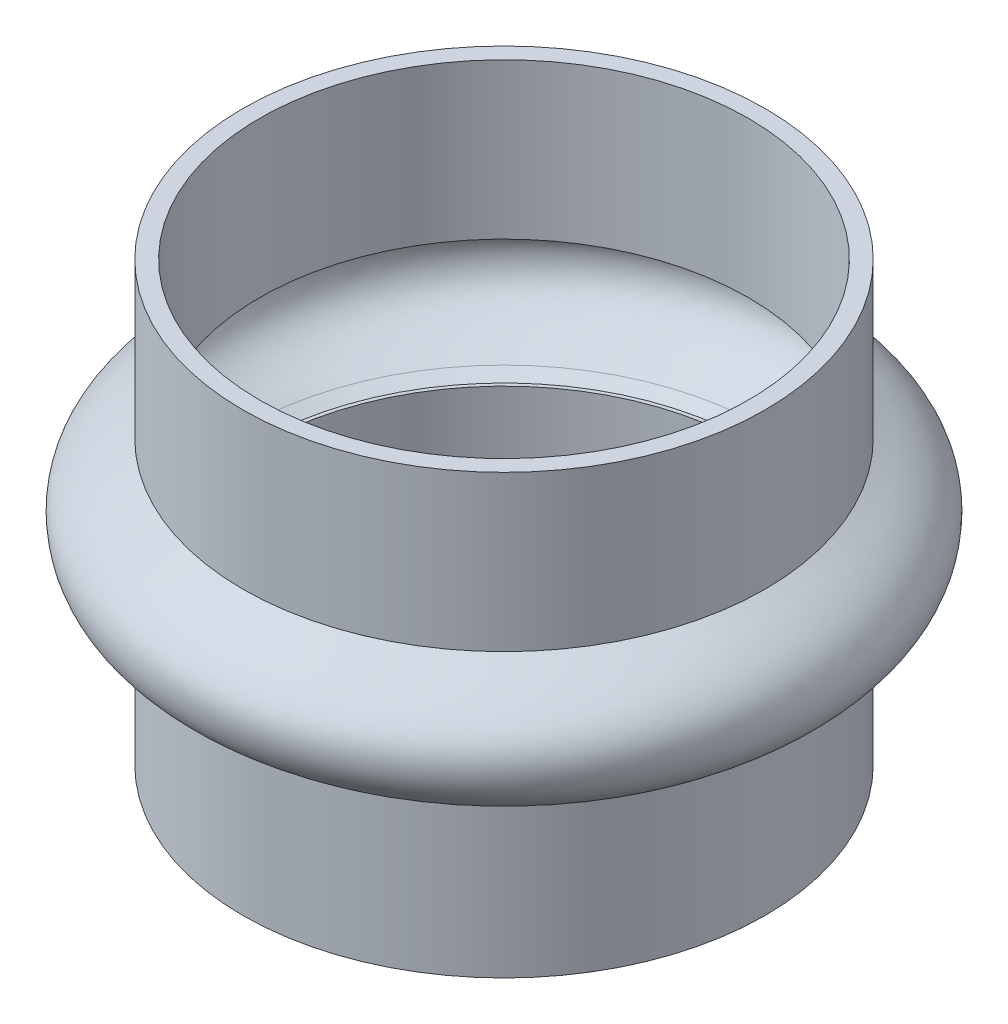
from build123d import *

# Parameters (mm, degrees)
SKETCH2_R           = 16.815
SKETCH2_R_2         = 15.729321286
BOSS_EXTRUDE1_DEPTH = 10


with BuildPart() as part:
    # Sketch1 → Revolve1 (revolve)
    with BuildSketch(Plane.XY):
        with BuildLine():
            Line((7.325278854, 63.411883954), (8.410957568, 63.411883954))
            Line((8.410957568, 63.411883954), (7.555549556, 62.968064842))
            add(Edge.make_bspline(
                [(7.555549556, 62.968064842), (7.34999991, 62.861417651), (6.947144673, 62.660387479), (6.05410487, 62.201842629), (4.95450234, 61.540590874), (4.15954484, 60.725704583), (3.843595581, 60.013758398), (3.734630504, 59.178179351), (3.989989442, 58.064696871), (4.831837818, 57.106551686), (6.08596344, 56.311379341), (6.949277865, 55.883126275), (7.373486281, 55.648841265)],
                knots=[0, 0, 0, 0, 0.0625, 0.125, 0.25, 0.375, 0.4375, 0.5, 0.625, 0.75, 0.875, 1, 1, 1, 1], degree=3))
            Line((7.373486281, 55.648841265), (8.165980219, 55.21115676))
            Line((8.165980219, 55.21115676), (7.131758595, 55.21115676))
            add(Edge.make_bspline(
                [(7.325278854, 63.411883954), (6.011135244, 62.730054884), (2.971783405, 61.4251647), (3.46335157, 56.912604996), (5.942640085, 55.867892063), (7.131758595, 55.21115676)],
                knots=[0, 0, 0, 0, 0.430000258, 0.624673055, 1, 1, 1, 1], degree=3))
        make_face()
    revolve(axis=Axis((24.140278854, 76.539342874, 0), (0, -1, 0)))

    # Sketch2 → Boss-Extrude1 (add)
    with BuildSketch(Plane(origin=(0, 63.411883954, 0), x_dir=(1, 0, 0), z_dir=(0, 1, 0))):
        with Locations(Location((24.140278854, 0, 0), (0, 0, 180))):
            Circle(SKETCH2_R)
        with Locations(Location((24.140278854, 0, 0), (0, 0, 270))):
            Circle(SKETCH2_R_2, mode=Mode.SUBTRACT)
    boss_extrude1 = extrude(amount=BOSS_EXTRUDE1_DEPTH)

    # Mirror1: Boss-Extrude1 across plane
    add(boss_extrude1.mirror(Plane.ZX.offset(59.311520357)))


solid = part.part
